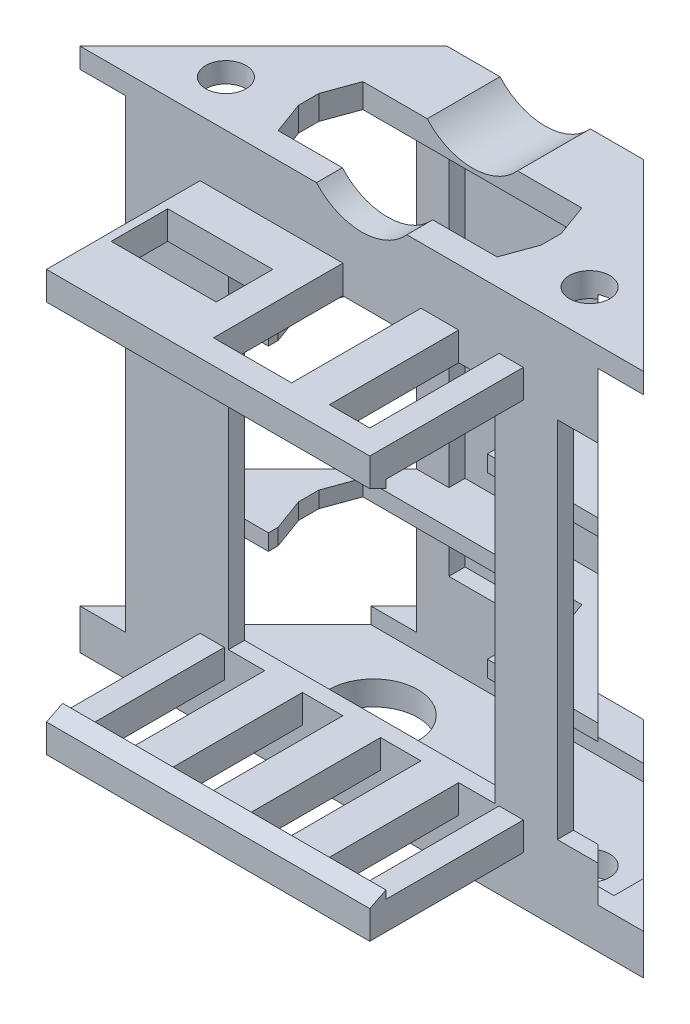
from build123d import *

# Parameters (mm, degrees)
EXTRUDE_1_DEPTH                      = 65
CUT_EXTRUDE_1_DEPTH                  = 57.5
SKETCH_4_R                           = 7.5
CUT_EXTRUDE_2_DEPTH                  = 84.384960275
EXTRUDE_3_DEPTH                      = 20
SKETCH_8_W                           = 58.426291502
SKETCH_8_H                           = 17.5
SKETCH_8_H_2                         = 20
CUT_EXTRUDE_3_DEPTH                  = 16
SKETCH_9_W                           = 33
SKETCH_9_H                           = 45
SKETCH_9_W_2                         = 12.187816983
CUT_EXTRUDE_4_DEPTH                  = 2
CUT_EXTRUDE_5_REACH                  = 87.532
SKETCH_10_W                          = 13
SKETCH_10_H                          = 7
RIB_6_REACH                          = 86.734
SKETCH_12_WALL_W                     = 8.07774721
SKETCH_12_WALL_H                     = 0.75
PATTERN_LINEAR_3_COUNT               = 3
PATTERN_LINEAR_3_PITCH               = 10
PATTERN_LINEAR_3_COPY_1_REACH        = 86.734
PATTERN_LINEAR_3_COPY_1_SKETCH_W     = 8.07774721
PATTERN_LINEAR_3_COPY_1_SKETCH_H     = 0.75
PATTERN_LINEAR_3_COPY_2_REACH        = 86.734
PATTERN_LINEAR_3_COPY_2_SKETCH_W     = 8.07774721
PATTERN_LINEAR_3_COPY_2_SKETCH_H     = 0.75
PATTERN_LINEAR_3_COL_COUNT           = 3
PATTERN_LINEAR_3_COL_PITCH           = 10
PATTERN_LINEAR_3_COL_COPY_1_REACH    = 86.734
PATTERN_LINEAR_3_COL_COPY_1_SKETCH_W = 8.07774721
PATTERN_LINEAR_3_COL_COPY_1_SKETCH_H = 0.75
PATTERN_LINEAR_3_COL_COPY_2_REACH    = 86.734
PATTERN_LINEAR_3_COL_COPY_2_SKETCH_W = 8.07774721
PATTERN_LINEAR_3_COL_COPY_2_SKETCH_H = 0.75
SKETCH_13_W                          = 24.34
SKETCH_13_H                          = 5
CUT_EXTRUDE_6_DEPTH                  = 3
SKETCH_14_W                          = 14.426291502
SKETCH_14_H                          = 14.5
SKETCH_14_H_2                        = 7.5
SKETCH_14_H_3                        = 20
CUT_EXTRUDE_7_DEPTH                  = 2
CUT_EXTRUDE_8_DEPTH                  = 62
SKETCH_16_W                          = 27.088238126
SKETCH_16_H                          = 24
CUT_EXTRUDE_9_DEPTH                  = 2
SKETCH_17_R                          = 5.5
CUT_EXTRUDE_10_DEPTH                 = 89.292987264
CUT_EXTRUDE_11_REACH                 = 92.425
SKETCH_18_R                          = 2.5
CUT_EXTRUDE_12_REACH                 = 88.213
SKETCH_19_W                          = 5
SKETCH_19_H                          = 16
CUT_EXTRUDE_13_REACH                 = 87.532
SKETCH_20_W                          = 5
SKETCH_20_H                          = 16
SKETCH_20_W_2                        = 9.666666666


with BuildPart() as part:
    # 草圖1 → 填料-伸長1 (new body)
    with BuildSketch(Plane(origin=(0, 0, 0), x_dir=(1, 0, 0), z_dir=(0, 1, 0))):
        Polygon((0, 0), (24.34, 0), (47.04, -22.7), (-22.7, -22.7), align=None)
    extrude(amount=EXTRUDE_1_DEPTH)

    # 草圖2 → 除料-伸長1 (cut)
    with BuildSketch(Plane(origin=(0, 5, 0), x_dir=(1, 0, 0), z_dir=(0, 1, 0))):
        Polygon((0, 0), (-22.7, -22.7), (-17.043145751, -22.7), (5.656854249, 0), align=None)
    cut_extrude_1 = extrude(amount=CUT_EXTRUDE_1_DEPTH, mode=Mode.SUBTRACT)

    # 鏡射1: 除料-伸長1 across plane
    add(cut_extrude_1.mirror(Plane.ZY.offset(-12.17)), mode=Mode.SUBTRACT)

    # 草圖4 → 除料-伸長2 (cut, through all)
    with BuildSketch(Plane.XY.offset(22.7)):
        with Locations((12.17, 70)):
            Circle(SKETCH_4_R)
    extrude(amount=-CUT_EXTRUDE_2_DEPTH, mode=Mode.SUBTRACT)

    # 草圖7 → 填料-伸長3 (add, symmetric)
    with BuildSketch(Plane(origin=(12.17, 44.17, 0), x_dir=(0, -1, 0), z_dir=(1, 0, 0))):
        Polygon((34.67, -22.7), (38.17, -22.7), (38.17, -41.7), (34.67, -41.7), (33.67, -39.7), (34.67, -39.7), align=None)
        Polygon((-10.33, -22.7), (-13.83, -22.7), (-13.83, -41.7), (-10.33, -41.7), (-9.33, -39.7), (-10.33, -39.7), align=None)
    extrude(amount=EXTRUDE_3_DEPTH, both=True)

    # 草圖8 → 除料-伸長3 (cut)
    with BuildSketch(Plane.XY.offset(20.7)):
        with Locations((12.17, 11.75)):
            Rectangle(SKETCH_8_W, SKETCH_8_H)
        with Locations((12.17, 53.25)):
            Rectangle(SKETCH_8_W, SKETCH_8_H)
        with Locations((12.17, 32.5)):
            Rectangle(SKETCH_8_W, SKETCH_8_H_2)
    extrude(amount=-CUT_EXTRUDE_3_DEPTH, mode=Mode.SUBTRACT)

    # 草圖9 → 除料-伸長4 (cut)
    with BuildSketch(Plane.XY.offset(22.7)):
        with Locations((12.17, 32)):
            Rectangle(SKETCH_9_W, SKETCH_9_H)
        with Locations((42.463908492, 32)):
            Rectangle(SKETCH_9_W_2, SKETCH_9_H)
    extrude(amount=-CUT_EXTRUDE_4_DEPTH, mode=Mode.SUBTRACT)

    # 草圖10 → 除料-伸長5 (cut, up to next)
    with BuildSketch(Plane(origin=(0, 58, 0), x_dir=(1, 0, 0), z_dir=(0, 1, 0)), mode=Mode.PRIVATE) as cut_extrude_5_sk1:
        with Locations((-0.33, -31.2)):
            Rectangle(SKETCH_10_W, SKETCH_10_H)
    cut_extrude_5_tool1 = extrude(cut_extrude_5_sk1.sketch, amount=-CUT_EXTRUDE_5_REACH, mode=Mode.PRIVATE) & part.part
    add(cut_extrude_5_tool1.solids().sort_by_distance((-0.33, 58, 31.2))[0], mode=Mode.SUBTRACT)

    # 草圖12 wall → 肋材6 (add, up to next)
    with BuildSketch(Plane(origin=(12.17, 58.25, 19.2), x_dir=(0, 0.928476690885, -0.371390676354), z_dir=(0, -0.371390676354, -0.928476690885)), mode=Mode.PRIVATE) as rib_6_sk1:
        Rectangle(SKETCH_12_WALL_W, SKETCH_12_WALL_H)
    rib_6_tool1 = extrude(rib_6_sk1.sketch, amount=-RIB_6_REACH, mode=Mode.PRIVATE) - part.part
    rib_6 = rib_6_tool1.solids().sort_by_distance((12.17, 58.25, 19.2))[0]
    add(rib_6)

    # 鏡射2: 肋材6 across plane
    add(rib_6.mirror(Plane.ZX.offset(32)))

    # 直線複製排列3: 肋材6 ×3
    with Locations(*[(i * PATTERN_LINEAR_3_PITCH, 0, 0) for i in range(1, PATTERN_LINEAR_3_COUNT)]):
        add(rib_6)

    # 直線複製排列3 copy 1 sketch → 直線複製排列3 copy 1 (add, up to next)
    with BuildSketch(Plane(origin=(22.17, 5.75, 19.2), x_dir=(0, -0.928476690885, -0.371390676354), z_dir=(0, 0.371390676354, -0.928476690885)), mode=Mode.PRIVATE) as pattern_linear_3_copy_1_sk1:
        Rectangle(PATTERN_LINEAR_3_COPY_1_SKETCH_W, PATTERN_LINEAR_3_COPY_1_SKETCH_H)
    pattern_linear_3_copy_1_tool1 = extrude(pattern_linear_3_copy_1_sk1.sketch, amount=-PATTERN_LINEAR_3_COPY_1_REACH, mode=Mode.PRIVATE) - part.part
    add(pattern_linear_3_copy_1_tool1.solids().sort_by_distance((22.17, 5.75, 19.2))[0])

    # 直線複製排列3 copy 2 sketch → 直線複製排列3 copy 2 (add, up to next)
    with BuildSketch(Plane(origin=(32.17, 5.75, 19.2), x_dir=(0, -0.928476690885, -0.371390676354), z_dir=(0, 0.371390676354, -0.928476690885)), mode=Mode.PRIVATE) as pattern_linear_3_copy_2_sk1:
        Rectangle(PATTERN_LINEAR_3_COPY_2_SKETCH_W, PATTERN_LINEAR_3_COPY_2_SKETCH_H)
    pattern_linear_3_copy_2_tool1 = extrude(pattern_linear_3_copy_2_sk1.sketch, amount=-PATTERN_LINEAR_3_COPY_2_REACH, mode=Mode.PRIVATE) - part.part
    add(pattern_linear_3_copy_2_tool1.solids().sort_by_distance((32.17, 5.75, 19.2))[0])

    # 直線複製排列3 col: 肋材6 ×3
    with Locations(*[(-i * PATTERN_LINEAR_3_COL_PITCH, 0, 0) for i in range(1, PATTERN_LINEAR_3_COL_COUNT)]):
        add(rib_6)

    # 直線複製排列3 col copy 1 sketch → 直線複製排列3 col copy 1 (add, up to next)
    with BuildSketch(Plane(origin=(2.17, 5.75, 19.2), x_dir=(0, -0.928476690885, -0.371390676354), z_dir=(0, 0.371390676354, -0.928476690885)), mode=Mode.PRIVATE) as pattern_linear_3_col_copy_1_sk1:
        Rectangle(PATTERN_LINEAR_3_COL_COPY_1_SKETCH_W, PATTERN_LINEAR_3_COL_COPY_1_SKETCH_H)
    pattern_linear_3_col_copy_1_tool1 = extrude(pattern_linear_3_col_copy_1_sk1.sketch, amount=-PATTERN_LINEAR_3_COL_COPY_1_REACH, mode=Mode.PRIVATE) - part.part
    add(pattern_linear_3_col_copy_1_tool1.solids().sort_by_distance((2.17, 5.75, 19.2))[0])

    # 直線複製排列3 col copy 2 sketch → 直線複製排列3 col copy 2 (add, up to next)
    with BuildSketch(Plane(origin=(-7.83, 5.75, 19.2), x_dir=(0, -0.928476690885, -0.371390676354), z_dir=(0, 0.371390676354, -0.928476690885)), mode=Mode.PRIVATE) as pattern_linear_3_col_copy_2_sk1:
        Rectangle(PATTERN_LINEAR_3_COL_COPY_2_SKETCH_W, PATTERN_LINEAR_3_COL_COPY_2_SKETCH_H)
    pattern_linear_3_col_copy_2_tool1 = extrude(pattern_linear_3_col_copy_2_sk1.sketch, amount=-PATTERN_LINEAR_3_COL_COPY_2_REACH, mode=Mode.PRIVATE) - part.part
    add(pattern_linear_3_col_copy_2_tool1.solids().sort_by_distance((-7.83, 5.75, 19.2))[0])

    # 草圖13 → 除料-伸長6 (cut)
    with BuildSketch(Plane(origin=(0, 0, 0), x_dir=(-1, 0, 0), z_dir=(0, 0, -1))):
        with Locations((-12.17, 7.5)):
            Rectangle(SKETCH_13_W, SKETCH_13_H)
    extrude(amount=-CUT_EXTRUDE_6_DEPTH, mode=Mode.SUBTRACT)

    # 草圖14 → 除料-伸長7 (cut)
    with BuildSketch(Plane.XY.offset(4.7)):
        with Locations((12.17, 51.75)):
            Rectangle(SKETCH_14_W, SKETCH_14_H)
        with Locations((12.17, 16.75)):
            Rectangle(SKETCH_14_W, SKETCH_14_H_2)
        with Locations((12.17, 32.5)):
            Rectangle(SKETCH_14_W, SKETCH_14_H_3)
    extrude(amount=-CUT_EXTRUDE_7_DEPTH, mode=Mode.SUBTRACT)

    # 草圖15 → 除料-伸長8 (cut)
    with BuildSketch(Plane.XZ.offset(-65)):
        Polygon((-1.374119063, 9), (-2.83, 13), (-2.83, 15.5), (-1.374119063, 19.5), (25.714119063, 19.5), (27.17, 15.5), (27.17, 13), (25.714119063, 9), align=None)
    extrude(amount=CUT_EXTRUDE_8_DEPTH, mode=Mode.SUBTRACT)

    # 草圖16 → 除料-伸長9 (cut)
    with BuildSketch(Plane.XY.offset(20.7)):
        with Locations((12.17, 32.5)):
            Rectangle(SKETCH_16_W, SKETCH_16_H)
    extrude(amount=-CUT_EXTRUDE_9_DEPTH, mode=Mode.SUBTRACT)

    # 草圖17 → 除料-伸長10 (cut, through all)
    with BuildSketch(Plane(origin=(0, 3, 0), x_dir=(1, 0, 0), z_dir=(0, 1, 0))):
        with Locations(Location((5.17, -14.25, 0), (0, 0, 180))):
            Circle(SKETCH_17_R)
    extrude(amount=-CUT_EXTRUDE_10_DEPTH, mode=Mode.SUBTRACT)

    # 草圖18 → 除料-伸長11 (cut, up to next)
    with BuildSketch(Plane(origin=(0, 65, 0), x_dir=(1, 0, 0), z_dir=(0, 1, 0)), mode=Mode.PRIVATE) as cut_extrude_11_sk1:
        with Locations(Location((34.67, -17, 0), (0, 0, 270))):
            Circle(SKETCH_18_R)
    cut_extrude_11_tool1 = extrude(cut_extrude_11_sk1.sketch, amount=-CUT_EXTRUDE_11_REACH, mode=Mode.PRIVATE) & part.part
    # 草圖18 → 除料-伸長11 (cut, up to next)
    with BuildSketch(Plane(origin=(0, 65, 0), x_dir=(1, 0, 0), z_dir=(0, 1, 0)), mode=Mode.PRIVATE) as cut_extrude_11_sk2:
        with Locations(Location((-10.33, -17, 0), (0, 0, 270))):
            Circle(SKETCH_18_R)
    cut_extrude_11_tool2 = extrude(cut_extrude_11_sk2.sketch, amount=-CUT_EXTRUDE_11_REACH, mode=Mode.PRIVATE) & part.part
    cut_extrude_11_1 = cut_extrude_11_tool1.solids().sort_by_distance((34.67, 65, 17))[0]
    add(cut_extrude_11_1, mode=Mode.SUBTRACT)
    cut_extrude_11_2 = cut_extrude_11_tool2.solids().sort_by_distance((-10.33, 65, 17))[0]
    add(cut_extrude_11_2, mode=Mode.SUBTRACT)
    cut_extrude_11 = cut_extrude_11_1 + cut_extrude_11_2  # 除料-伸長11 as one shape, for the pattern or mirror that repeats it

    # 鏡射3: 除料-伸長11 mirrored; each copy of 除料-伸長11 runs up to whatever stops it at its own place
    mirror_3_before = part.part  # the part as the pattern finds it: every copy runs up to it
    mirror_3_cut_extrude_11_long1 = extrude(cut_extrude_11_sk1.sketch, amount=-CUT_EXTRUDE_11_REACH, mode=Mode.PRIVATE)
    mirror_3_cut_extrude_11_long2 = extrude(cut_extrude_11_sk2.sketch, amount=-CUT_EXTRUDE_11_REACH, mode=Mode.PRIVATE)
    mirror_3_cut_extrude_11_tool1_1 = mirror_3_cut_extrude_11_long1.mirror(Plane.ZX.offset(32)) & mirror_3_before
    add(mirror_3_cut_extrude_11_tool1_1.solids().sort_by_distance((34.67, -1, 17))[0], mode=Mode.SUBTRACT)
    mirror_3_cut_extrude_11_tool2_1 = mirror_3_cut_extrude_11_long2.mirror(Plane.ZX.offset(32)) & mirror_3_before
    add(mirror_3_cut_extrude_11_tool2_1.solids().sort_by_distance((-10.33, -1, 17))[0], mode=Mode.SUBTRACT)

    # 草圖19 → 除料-伸長12 (cut, up to next)
    with BuildSketch(Plane.XZ.offset(-6), mode=Mode.PRIVATE) as cut_extrude_12_sk1:
        with Locations((-2.33, 30.7)):
            Rectangle(SKETCH_19_W, SKETCH_19_H)
    cut_extrude_12_tool1 = extrude(cut_extrude_12_sk1.sketch, amount=-CUT_EXTRUDE_12_REACH, mode=Mode.PRIVATE) & part.part
    # 草圖19 → 除料-伸長12 (cut, up to next)
    with BuildSketch(Plane.XZ.offset(-6), mode=Mode.PRIVATE) as cut_extrude_12_sk2:
        with Locations((7.336666667, 30.7)):
            Rectangle(SKETCH_19_W, SKETCH_19_H)
    cut_extrude_12_tool2 = extrude(cut_extrude_12_sk2.sketch, amount=-CUT_EXTRUDE_12_REACH, mode=Mode.PRIVATE) & part.part
    # 草圖19 → 除料-伸長12 (cut, up to next)
    with BuildSketch(Plane.XZ.offset(-6), mode=Mode.PRIVATE) as cut_extrude_12_sk3:
        with Locations((26.67, 30.7)):
            Rectangle(SKETCH_19_W, SKETCH_19_H)
    cut_extrude_12_tool3 = extrude(cut_extrude_12_sk3.sketch, amount=-CUT_EXTRUDE_12_REACH, mode=Mode.PRIVATE) & part.part
    # 草圖19 → 除料-伸長12 (cut, up to next)
    with BuildSketch(Plane.XZ.offset(-6), mode=Mode.PRIVATE) as cut_extrude_12_sk4:
        with Locations((17.003333333, 30.7)):
            Rectangle(SKETCH_19_W, SKETCH_19_H)
    cut_extrude_12_tool4 = extrude(cut_extrude_12_sk4.sketch, amount=-CUT_EXTRUDE_12_REACH, mode=Mode.PRIVATE) & part.part
    add(cut_extrude_12_tool1.solids().sort_by_distance((-2.33, 6, 30.7))[0], mode=Mode.SUBTRACT)
    add(cut_extrude_12_tool2.solids().sort_by_distance((7.336667, 6, 30.7))[0], mode=Mode.SUBTRACT)
    add(cut_extrude_12_tool3.solids().sort_by_distance((26.67, 6, 30.7))[0], mode=Mode.SUBTRACT)
    add(cut_extrude_12_tool4.solids().sort_by_distance((17.003333, 6, 30.7))[0], mode=Mode.SUBTRACT)

    # 草圖20 → 除料-伸長13 (cut, up to next)
    with BuildSketch(Plane(origin=(0, 58, 0), x_dir=(1, 0, 0), z_dir=(0, 1, 0)), mode=Mode.PRIVATE) as cut_extrude_13_sk1:
        with Locations((26.67, -30.7)):
            Rectangle(SKETCH_20_W, SKETCH_20_H)
    cut_extrude_13_tool1 = extrude(cut_extrude_13_sk1.sketch, amount=-CUT_EXTRUDE_13_REACH, mode=Mode.PRIVATE) & part.part
    # 草圖20 → 除料-伸長13 (cut, up to next)
    with BuildSketch(Plane(origin=(0, 58, 0), x_dir=(1, 0, 0), z_dir=(0, 1, 0)), mode=Mode.PRIVATE) as cut_extrude_13_sk2:
        with Locations((14.67, -30.7)):
            Rectangle(SKETCH_20_W_2, SKETCH_20_H)
    cut_extrude_13_tool2 = extrude(cut_extrude_13_sk2.sketch, amount=-CUT_EXTRUDE_13_REACH, mode=Mode.PRIVATE) & part.part
    add(cut_extrude_13_tool1.solids().sort_by_distance((26.67, 58, 30.7))[0], mode=Mode.SUBTRACT)
    add(cut_extrude_13_tool2.solids().sort_by_distance((14.67, 58, 30.7))[0], mode=Mode.SUBTRACT)


solid = part.part
